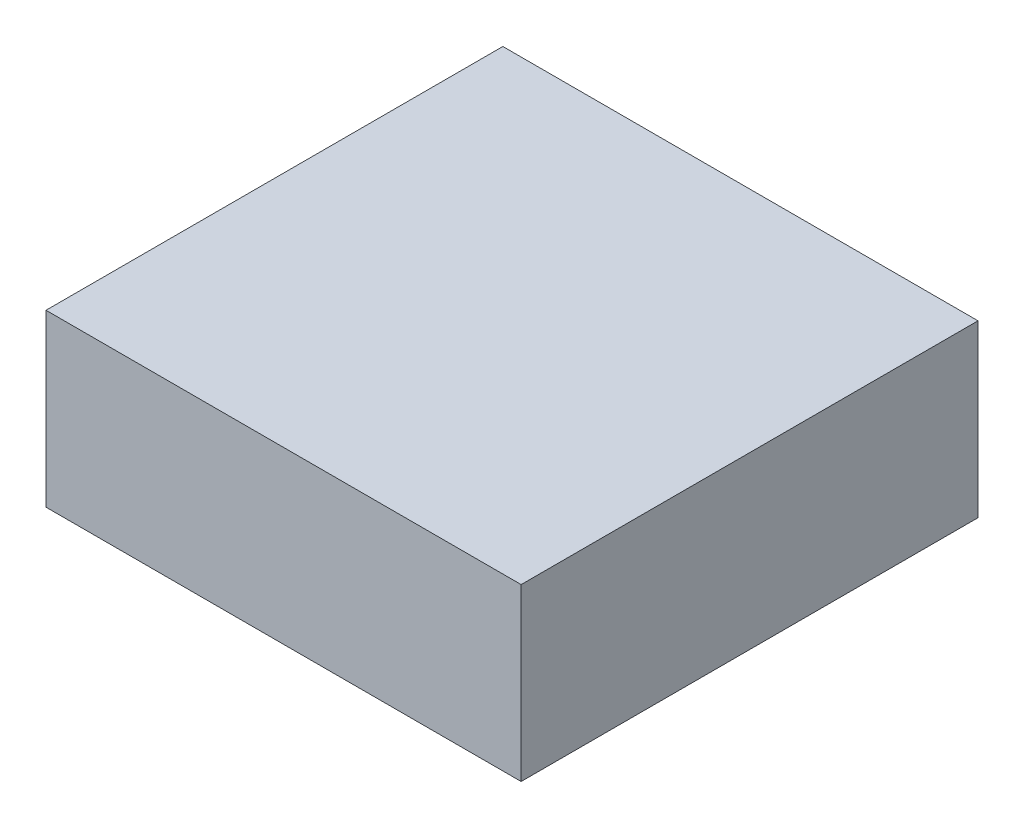
from build123d import *

# Parameters (mm, degrees)
SKETCH1_W           = 78
SKETCH1_H           = 75
BOSS_EXTRUDE1_DEPTH = 28


with BuildPart() as part:
    # Sketch1 → Boss-Extrude1 (new body)
    with BuildSketch(Plane(origin=(0, 0, 0), x_dir=(1, 0, 0), z_dir=(0, 1, 0))):
        with Locations((39, 37.5)):
            Rectangle(SKETCH1_W, SKETCH1_H)
    extrude(amount=BOSS_EXTRUDE1_DEPTH)


solid = part.part
